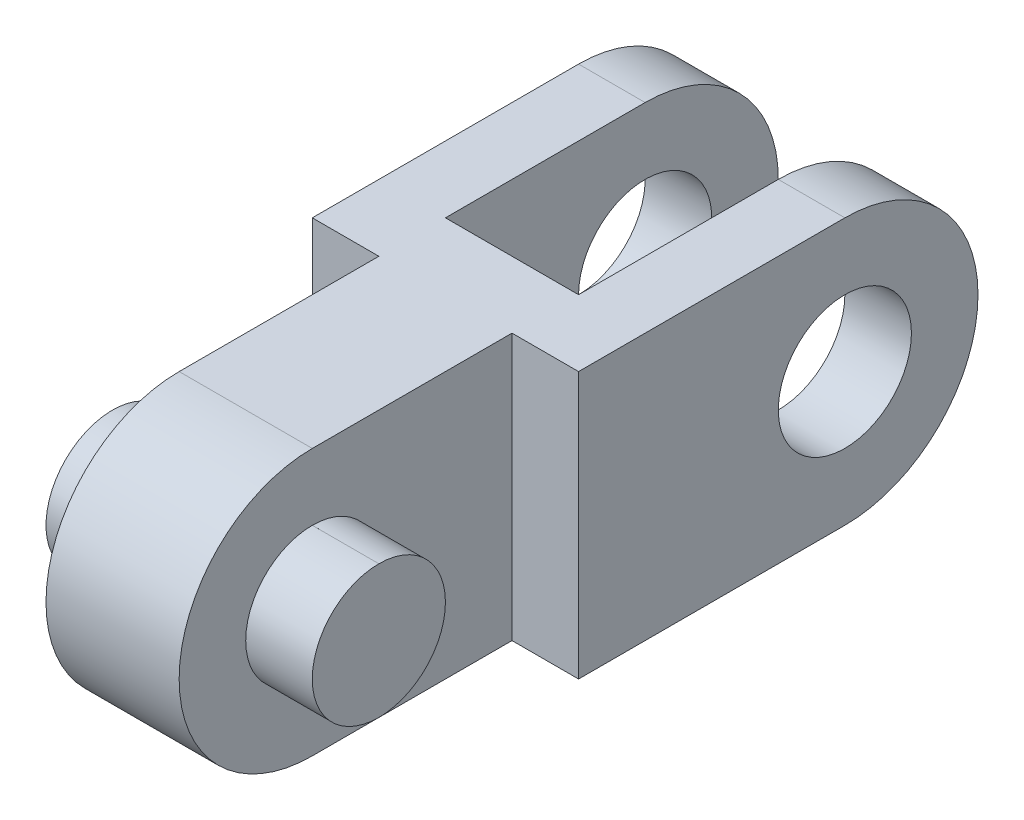
from build123d import *

# Parameters (mm, degrees)
BOSS_EXTRUDE1_DEPTH          = 10
SKETCH2_W                    = 2.5
SKETCH2_H                    = 7.5
CUT_EXTRUDE1_DEPTH           = 31.923292192
SKETCH3_W                    = 5
SKETCH3_H                    = 7.5
CUT_EXTRUDE2_DEPTH           = 31.923292192
SKETCH4_W                    = 2.5
SKETCH4_H                    = 7.5
CUT_EXTRUDE3_DEPTH           = 31.923292192
SKETCH5_W                    = 2.5
SKETCH5_H                    = 2.5
SKETCH6_W                    = 2.5
SKETCH6_H                    = 2.5
F_5_0_5_DIAMETER_HOLE1_D     = 5
F_5_0_5_DIAMETER_HOLE1_DEPTH = 2.5
F_5_0_5_DIAMETER_HOLE2_D     = 5
F_5_0_5_DIAMETER_HOLE2_DEPTH = 2.5
SKETCH11_W                   = 5
SKETCH11_H                   = 5.816268322
CUT_EXTRUDE4_DEPTH           = 10
CUT_EXTRUDE5_DEPTH           = 2.5
CUT_EXTRUDE6_DEPTH           = 2.5


with BuildPart() as part:
    # Sketch1 → Boss-Extrude1 (new body)
    with BuildSketch(Plane(origin=(0, 0, 0), x_dir=(0, -1, 0), z_dir=(-1, 0, 0))):
        with BuildLine():
            Line((0, 22.5), (0, 5))
            ThreePointArc((0, 5), (5, 0), (10, 5))
            Line((10, 5), (10, 22.5))
            ThreePointArc((10, 22.5), (5, 27.5), (0, 22.5))
        make_face()
    extrude(amount=-BOSS_EXTRUDE1_DEPTH)

    # Sketch2 → Cut-Extrude1 (cut, through all)
    with BuildSketch(Plane(origin=(0, 0, 0), x_dir=(-1, 0, 0), z_dir=(0, 1, 0))):
        with Locations((-1.25, 18.75)):
            Rectangle(SKETCH2_W, SKETCH2_H)
    extrude(amount=-CUT_EXTRUDE1_DEPTH, mode=Mode.SUBTRACT)

    # Sketch3 → Cut-Extrude2 (cut, through all)
    with BuildSketch(Plane(origin=(0, 0, 0), x_dir=(-1, 0, 0), z_dir=(0, 1, 0))):
        with Locations((-5, 8.75)):
            Rectangle(SKETCH3_W, SKETCH3_H)
    extrude(amount=-CUT_EXTRUDE2_DEPTH, mode=Mode.SUBTRACT)

    # Sketch4 → Cut-Extrude3 (cut, through all)
    with BuildSketch(Plane(origin=(0, 0, 0), x_dir=(-1, 0, 0), z_dir=(0, 1, 0))):
        with Locations((-8.75, 18.75)):
            Rectangle(SKETCH4_W, SKETCH4_H)
    extrude(amount=-CUT_EXTRUDE3_DEPTH, mode=Mode.SUBTRACT)

    # Sketch5 → Revolve1 (revolve)
    with BuildSketch(Plane.XY.offset(22.5)):
        with Locations((8.75, -3.75)):
            Rectangle(SKETCH5_W, SKETCH5_H)
    revolve(axis=Axis((7.5, -5, 22.5), (1, 0, 0)))

    # Sketch6 → Revolve2 (revolve)
    with BuildSketch(Plane.XY.offset(22.5)):
        with Locations((1.25, -3.75)):
            Rectangle(SKETCH6_W, SKETCH6_H)
    revolve(axis=Axis((0, -5, 22.5), (1, 0, 0)))

    # Ø5.0 (5) Diameter Hole1
    with Locations(Plane.ZY):
        with Locations((5, -5)):
            Hole(F_5_0_5_DIAMETER_HOLE1_D / 2, depth=F_5_0_5_DIAMETER_HOLE1_DEPTH)

    # Ø5.0 (5) Diameter Hole2
    with Locations(Plane(origin=(10, 0, 0), x_dir=(0, 0, -1), z_dir=(1, 0, 0))):
        with Locations((-5, -5)):
            Hole(F_5_0_5_DIAMETER_HOLE2_D / 2, depth=F_5_0_5_DIAMETER_HOLE2_DEPTH)

    # Sketch11 → Cut-Extrude4 (cut)
    with BuildSketch(Plane.XZ.offset(10)):
        with Locations((5, 2.091865839)):
            Rectangle(SKETCH11_W, SKETCH11_H)
    extrude(amount=-CUT_EXTRUDE4_DEPTH, mode=Mode.SUBTRACT)

    # Sketch12 → Cut-Extrude5 (cut)
    with BuildSketch(Plane(origin=(10, 0, 0), x_dir=(0, 0, -1), z_dir=(1, 0, 0))):
        with BuildLine():
            Line((-22.5, -7.5), (-22.5, -10.000084715))
            ThreePointArc((-22.5, -10.000084715), (-27.500042357, -5.000042357), (-22.5, 0))
            Line((-22.5, 0), (-22.5, -2.500084715))
            ThreePointArc((-22.5, -2.500084715), (-24.999957643, -5.000042357), (-22.5, -7.5))
        make_face()
    extrude(amount=-CUT_EXTRUDE5_DEPTH, mode=Mode.SUBTRACT)

    # Sketch13 → Cut-Extrude6 (cut)
    with BuildSketch(Plane.ZY):
        with BuildLine():
            Line((22.5, 0), (22.5, -2.5))
            ThreePointArc((22.5, -2.5), (25, -5), (22.5, -7.5))
            Line((22.5, -7.5), (22.5, -10))
            ThreePointArc((22.5, -10), (27.5, -5), (22.5, 0))
        make_face()
    extrude(amount=-CUT_EXTRUDE6_DEPTH, mode=Mode.SUBTRACT)


solid = part.part
